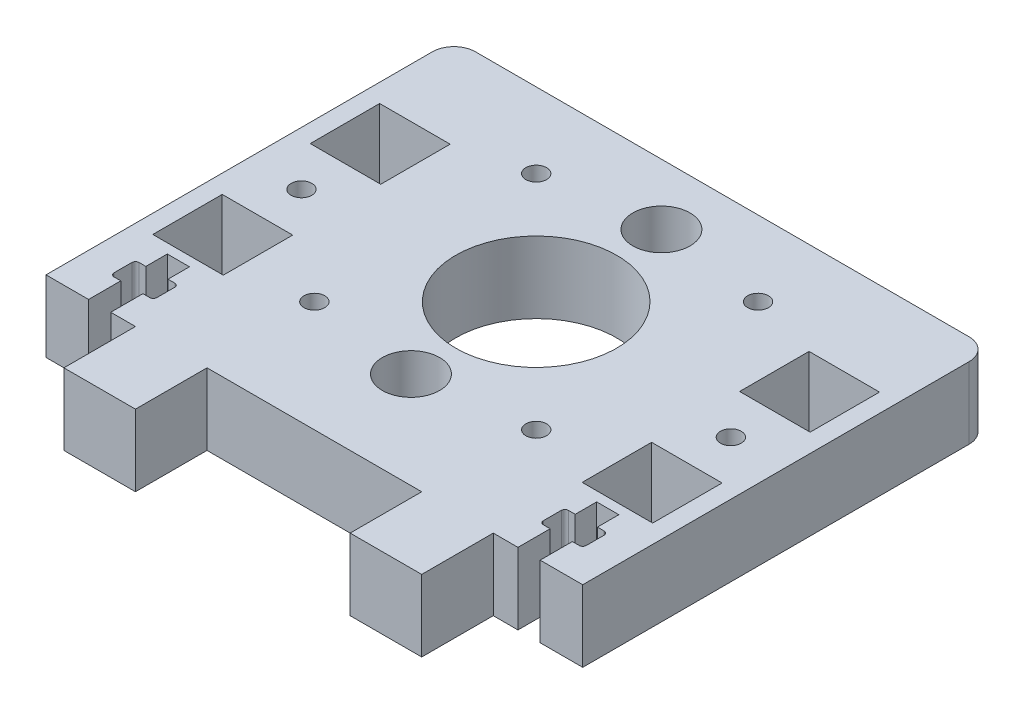
from build123d import *

# Parameters (mm, degrees)
SKETCH1_R          = 1.45
SKETCH1_W          = 9.85
SKETCH1_H          = 9.7
MAINLAYOUT_DEPTH   = 10
TSLOT_DEPTH        = 53.936282454
SKETCH3_R          = 4
CUT_EXTRUDE1_DEPTH = 53.936282454


with BuildPart() as part:
    # Sketch1 → MainLayout (new body)
    with BuildSketch(Plane(origin=(0, 0, 0), x_dir=(1, 0, 0), z_dir=(0, 1, 0))):
        with BuildLine():
            Line((-34.5, 31), (0, 31))
            Line((0, 31), (0, 16.25))
            ThreePointArc((0, 16.25), (-11.25, 5), (0, -6.25))
            Line((0, -6.25), (0, -8.5))
            ThreePointArc((0, -8.5), (-4, -12.5), (0, -16.5))
            Line((0, -16.5), (0, -26))
            Line((0, -26), (-15, -26))
            Line((-15, -26), (-15, -36))
            Line((-15, -36), (-25, -36))
            Line((-25, -36), (-25, -26))
            Line((-25, -26), (-37.5, -26))
            Line((-37.5, -26), (-37.5, 28))
            ThreePointArc((-37.5, 28), (-36.621320344, 30.121320344), (-34.5, 31))
        make_face()
        with Locations(Location((-15.5, 20.5, 0), (0, 0, 90))):
            Circle(SKETCH1_R, mode=Mode.SUBTRACT)
        with Locations(Location((-15.5, -10.5, 0), (0, 0, 270))):
            Circle(SKETCH1_R, mode=Mode.SUBTRACT)
        with Locations(Location((-30, 2.2, 0), (0, 0, 270))):
            Circle(SKETCH1_R, mode=Mode.SUBTRACT)
        with Locations((-30, 13.2)):
            Rectangle(SKETCH1_W, SKETCH1_H, mode=Mode.SUBTRACT)
        with Locations((-30, -8.8)):
            Rectangle(SKETCH1_W, SKETCH1_H, mode=Mode.SUBTRACT)
    mainlayout = extrude(amount=MAINLAYOUT_DEPTH)

    # Sketch2 → TSlot (cut, through all)
    with BuildSketch(Plane(origin=(0, 10, 0), x_dir=(1, 0, 0), z_dir=(0, 1, 0))):
        with BuildLine():
            Line((-28.45, -21.5), (-28.45, -26))
            Line((-28.45, -26), (-31.55, -26))
            Line((-31.55, -26), (-31.55, -21.5))
            Line((-31.55, -21.5), (-32.5, -21.5))
            ThreePointArc((-32.5, -21.5), (-32.853553391, -21.353553391), (-33, -21))
            Line((-33, -21), (-33, -18.5))
            ThreePointArc((-33, -18.5), (-32.853553391, -18.146446609), (-32.5, -18))
            Line((-32.5, -18), (-31.55, -18))
            Line((-31.55, -18), (-31.55, -15))
            Line((-31.55, -15), (-28.45, -15))
            Line((-28.45, -15), (-28.45, -18))
            Line((-28.45, -18), (-27.5, -18))
            ThreePointArc((-27.5, -18), (-27.146446609, -18.146446609), (-27, -18.5))
            Line((-27, -18.5), (-27, -21))
            ThreePointArc((-27, -21), (-27.146446609, -21.353553391), (-27.5, -21.5))
            Line((-27.5, -21.5), (-28.45, -21.5))
        make_face()
    tslot = extrude(amount=-TSLOT_DEPTH, mode=Mode.SUBTRACT)

    # Mirror1: MainLayout, TSlot across plane
    add(mainlayout.mirror(Plane(origin=(0, 0, 0), x_dir=(0, 0, 1), z_dir=(1, 0, 0))))
    add(tslot.mirror(Plane(origin=(0, 0, 0), x_dir=(0, 0, 1), z_dir=(1, 0, 0))), mode=Mode.SUBTRACT)

    # Sketch3 → Cut-Extrude1 (cut, through all)
    with BuildSketch(Plane(origin=(0, 10, 0), x_dir=(1, 0, 0), z_dir=(0, 1, 0))):
        with Locations(Location((0, 22.5, 0), (0, 0, 270))):
            Circle(SKETCH3_R)
    extrude(amount=-CUT_EXTRUDE1_DEPTH, mode=Mode.SUBTRACT)


solid = part.part
